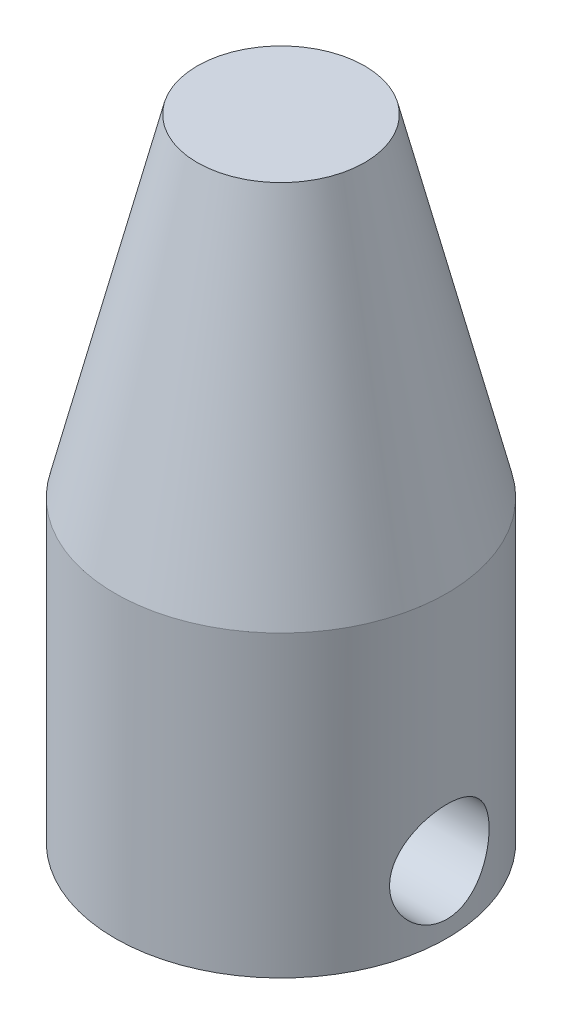
from build123d import *

# Parameters (mm, degrees)
SKETCH1_R             = 5
BODY_DEPTH            = 9
PIN_INSERT_DEPTH      = 12.445523142
PIN_INSERT_DEPTH_BACK = 12.445523142
SKETCH2_R             = 1.5
HEAD_SA_R             = 2.523


with BuildPart() as part:
    # Sketch1 → body (new body)
    with BuildSketch(Plane(origin=(0, 0, 0), x_dir=(1, 0, 0), z_dir=(0, 1, 0))):
        with Locations(Location((0, 0, 0), (0, 0, 270))):
            Circle(SKETCH1_R)
    extrude(amount=BODY_DEPTH)

    # Sketch2 → pin insert (cut, two sides: drawn at the far end of the back side and taken through both)
    with BuildSketch(Plane(origin=(0, 0, 0), x_dir=(0, 0, -1), z_dir=(1, 0, 0)).offset(-PIN_INSERT_DEPTH_BACK)):
        with Locations((0, 2)):
            Circle(SKETCH2_R)
    extrude(amount=PIN_INSERT_DEPTH + PIN_INSERT_DEPTH_BACK, mode=Mode.SUBTRACT)

    # head SA → section 0 of cone
    with BuildSketch(Plane(origin=(0, 19, 0), x_dir=(1, 0, 0), z_dir=(0, 1, 0)), mode=Mode.PRIVATE) as cone_s0:
        Circle(HEAD_SA_R)
    # loft up to a face of the part (cone)
    loft([cone_s0.sketch, part.faces().sort_by_distance((0, 9, 0))[0]])


solid = part.part
